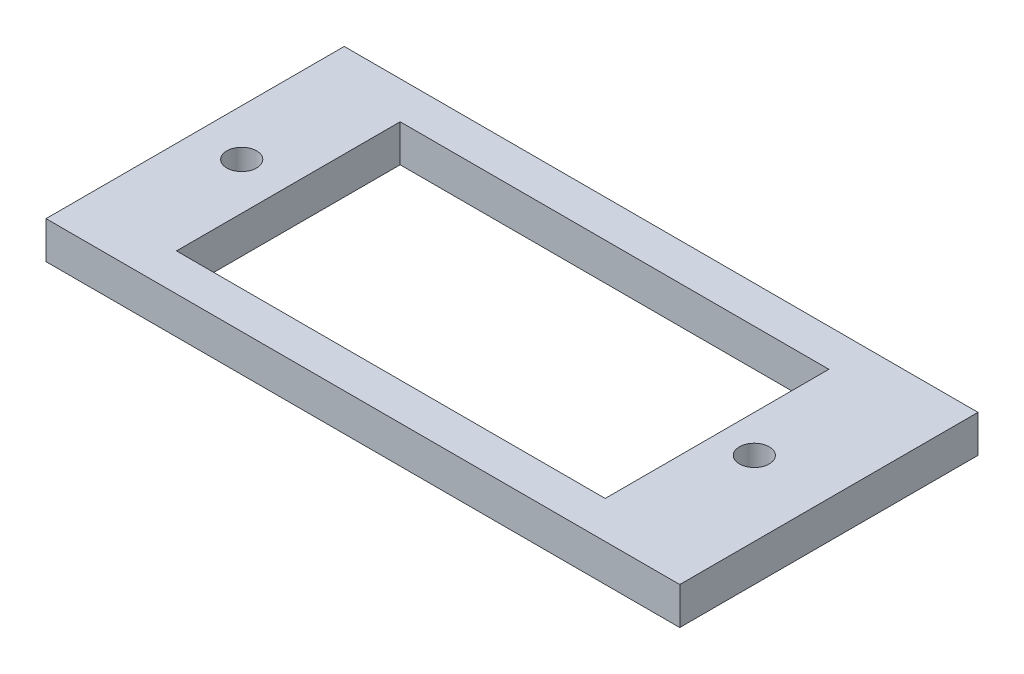
from build123d import *

# Parameters (mm, degrees)
SKETCH1_W               = 34
SKETCH1_H               = 16
BOSS_EXTRUDE1_DEPTH     = 2
CUT_EXTRUDE1_DEPTH      = 19.894443628
CUT_EXTRUDE1_DEPTH_BACK = 19.894443628
SKETCH2_W               = 23
SKETCH2_H               = 12
SKETCH3_R               = 0.8
CUT_EXTRUDE5_DEPTH      = 2


with BuildPart() as part:
    # Sketch1 → Boss-Extrude1 (new body)
    with BuildSketch(Plane(origin=(0, 0, 0), x_dir=(1, 0, 0), z_dir=(0, 1, 0))):
        Rectangle(SKETCH1_W, SKETCH1_H)
    extrude(amount=BOSS_EXTRUDE1_DEPTH)

    # Sketch2 → Cut-Extrude1 (cut, two sides: drawn at the far end of the back side and taken through both)
    with BuildSketch(Plane(origin=(0, 2, 0), x_dir=(1, 0, 0), z_dir=(0, 1, 0)).offset(-CUT_EXTRUDE1_DEPTH_BACK)):
        with Locations((-0.5, 0)):
            Rectangle(SKETCH2_W, SKETCH2_H)
    extrude(amount=CUT_EXTRUDE1_DEPTH + CUT_EXTRUDE1_DEPTH_BACK, mode=Mode.SUBTRACT)

    # Sketch3 → Cut-Extrude5 (cut)
    with BuildSketch(Plane(origin=(0, 0, 0), x_dir=(1, 0, 0), z_dir=(0, 1, 0))):
        with Locations(Location((-14.5, 0, 0), (0, 0, 270))):
            Circle(SKETCH3_R)
        with Locations(Location((13, 0, 0), (0, 0, 270))):
            Circle(SKETCH3_R)
    extrude(amount=CUT_EXTRUDE5_DEPTH, mode=Mode.SUBTRACT)


solid = part.part
